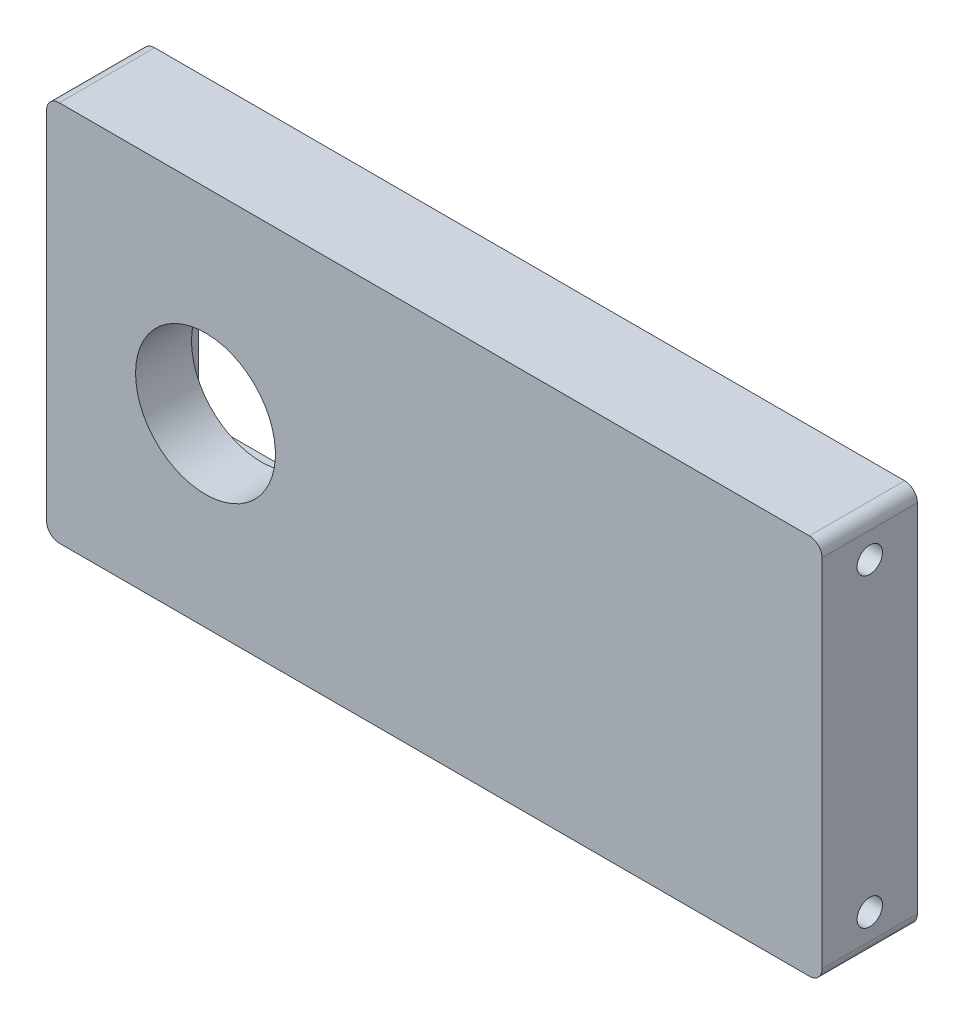
from build123d import *

# Parameters (mm, degrees)
BOSS_EXTRUDE1_DEPTH = 7.5
SKETCH2_R           = 2
CUT_EXTRUDE1_DEPTH  = 15
SKETCH3_R           = 11
CUT_EXTRUDE3_DEPTH  = 35
CUT_EXTRUDE5_DEPTH  = 6.2


with BuildPart() as part:
    # Sketch1 → Boss-Extrude1 (new, symmetric)
    with BuildSketch(Plane.XY):
        with BuildLine():
            Line((-59, 30), (59, 30))
            ThreePointArc((59, 30), (60.414213562, 29.414213562), (61, 28))
            Line((61, 28), (61, -28))
            ThreePointArc((61, -28), (60.414213562, -29.414213562), (59, -30))
            Line((59, -30), (-59, -30))
            ThreePointArc((-59, -30), (-60.414213562, -29.414213562), (-61, -28))
            Line((-61, -28), (-61, 28))
            ThreePointArc((-61, 28), (-60.414213562, 29.414213562), (-59, 30))
        make_face()
    extrude(amount=BOSS_EXTRUDE1_DEPTH, both=True)

    # Sketch2 → Cut-Extrude1 (cut)
    with BuildSketch(Plane(origin=(61, 0, 0), x_dir=(0, 0, -1), z_dir=(1, 0, 0))):
        with Locations(Location((0, 24, 0), (0, 0, 90))):
            Circle(SKETCH2_R)
        with Locations(Location((0, -24, 0), (0, 0, 270))):
            Circle(SKETCH2_R)
    extrude(amount=-CUT_EXTRUDE1_DEPTH, mode=Mode.SUBTRACT)

    # Sketch3 → Cut-Extrude3 (cut)
    with BuildSketch(Plane(origin=(0, 0, -7.5), x_dir=(-1, 0, 0), z_dir=(0, 0, -1))):
        with Locations((36, -0.850791996)):
            Circle(SKETCH3_R)
    extrude(amount=-CUT_EXTRUDE3_DEPTH, mode=Mode.SUBTRACT)

    # Sketch6 → Cut-Extrude5 (cut)
    with BuildSketch(Plane(origin=(0, 0, -7.5), x_dir=(-1, 0, 0), z_dir=(0, 0, -1))):
        Polygon((49.1, 15.249208004), (52.1, 12.249208004), (52.1, -13.950791996), (49.1, -16.950791996), (22.9, -16.950791996), (19.9, -13.950791996), (19.9, 12.249208004), (22.9, 15.249208004), align=None)
    extrude(amount=-CUT_EXTRUDE5_DEPTH, mode=Mode.SUBTRACT)


solid = part.part
